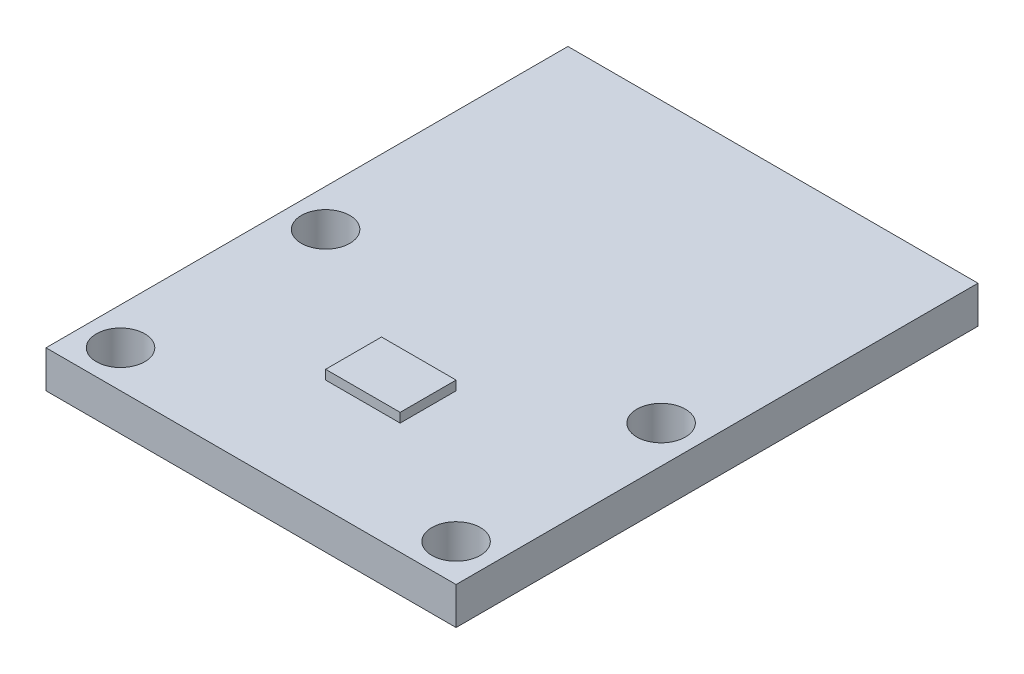
from build123d import *

# Parameters (mm, degrees)
SKETCH1_W           = 22
SKETCH1_H           = 28
SKETCH1_R           = 1.3
BOSS_EXTRUDE1_DEPTH = 2
SKETCH2_W           = 4
SKETCH2_H           = 3
BOSS_EXTRUDE2_DEPTH = 0.5


with BuildPart() as part:
    # Sketch1 → Boss-Extrude1 (new body)
    with BuildSketch(Plane(origin=(0, 0, 0), x_dir=(1, 0, 0), z_dir=(0, 1, 0))):
        Rectangle(SKETCH1_W, SKETCH1_H)
        with Locations(Location((9, -12, 0), (0, 0, 270))):
            Circle(SKETCH1_R, mode=Mode.SUBTRACT)
        with Locations(Location((-9, -12, 0), (0, 0, 270))):
            Circle(SKETCH1_R, mode=Mode.SUBTRACT)
        with Locations(Location((9, -1, 0), (0, 0, 270))):
            Circle(SKETCH1_R, mode=Mode.SUBTRACT)
        with Locations(Location((-9, -1, 0), (0, 0, 270))):
            Circle(SKETCH1_R, mode=Mode.SUBTRACT)
    extrude(amount=BOSS_EXTRUDE1_DEPTH)

    # Sketch2 → Boss-Extrude2 (add)
    with BuildSketch(Plane(origin=(0, 2, 0), x_dir=(1, 0, 0), z_dir=(0, 1, 0))):
        with Locations((0, -6.5)):
            Rectangle(SKETCH2_W, SKETCH2_H)
    extrude(amount=BOSS_EXTRUDE2_DEPTH)


solid = part.part
